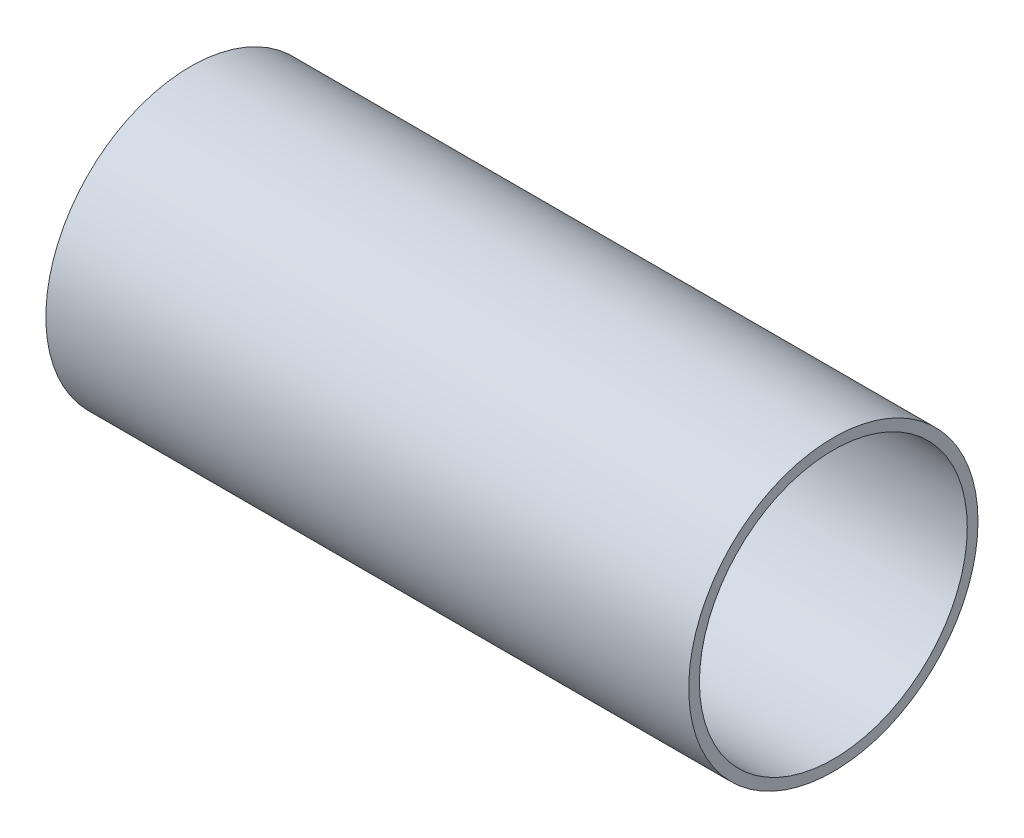
from build123d import *

# Parameters (mm, degrees)
SKETCH1_R   = 34.29
SKETCH1_R_2 = 31.75


with BuildPart() as part:
    # Sweep1: sweep along a curve in space
    with BuildLine() as sweep1_path:
        Line((0, 0, 0), (-152.4, 0, 0))
    # Sketch1 → Sweep1 (sweep)
    with BuildSketch(Plane(origin=(0, 0, 0), x_dir=(0, 0, -1), z_dir=(1, 0, 0))):
        Circle(SKETCH1_R)
        Circle(SKETCH1_R_2, mode=Mode.SUBTRACT)
    sweep(path=sweep1_path.line)


solid = part.part
